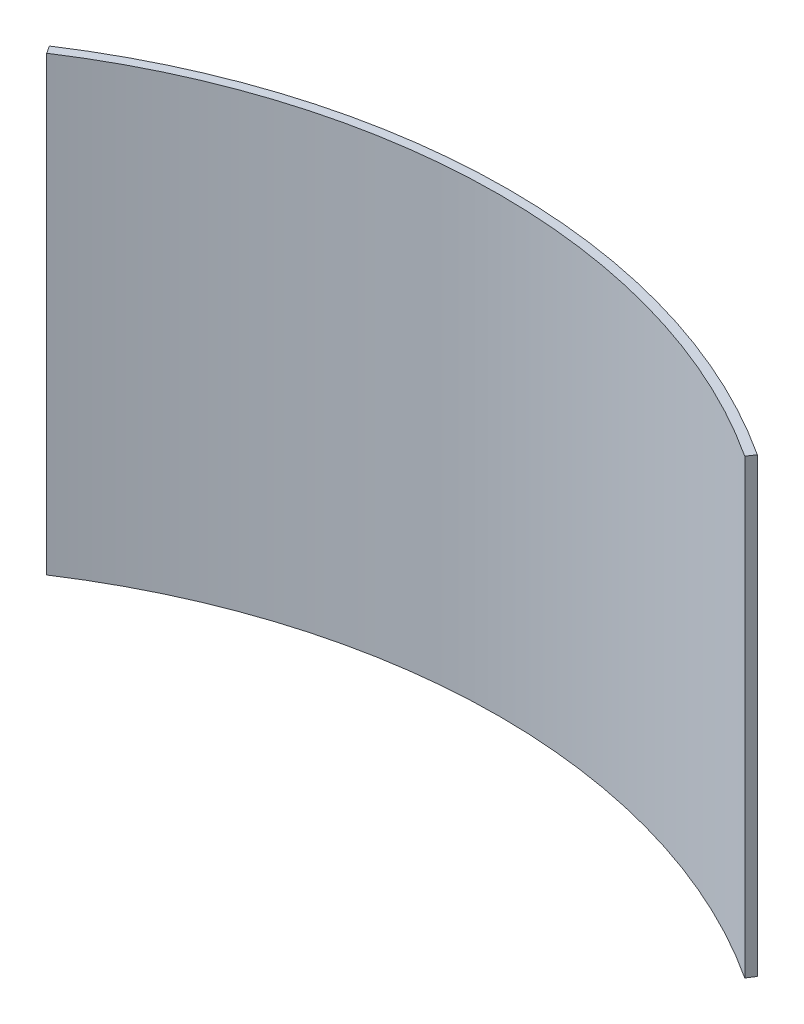
from build123d import *

# Parameters (mm, degrees)
EXTRUDE_1_DEPTH = 150


with BuildPart() as part:
    # Эскиз1 → Вытянуть-Тонкостенный1 (new body)
    with BuildSketch(Plane(origin=(0, 0, 0), x_dir=(1, 0, 0), z_dir=(0, 1, 0))):
        with BuildLine():
            ThreePointArc((14.64180055, 57.5), (132.14180055, 92.5), (249.64180055, 57.5))
            Line((249.64180055, 57.5), (248.000220508, 54.988981289))
            ThreePointArc((248.000220508, 54.988981289), (132.14180055, 89.5), (16.283380591, 54.988981289))
            Line((16.283380591, 54.988981289), (14.64180055, 57.5))
        make_face()
    extrude(amount=EXTRUDE_1_DEPTH)


solid = part.part
